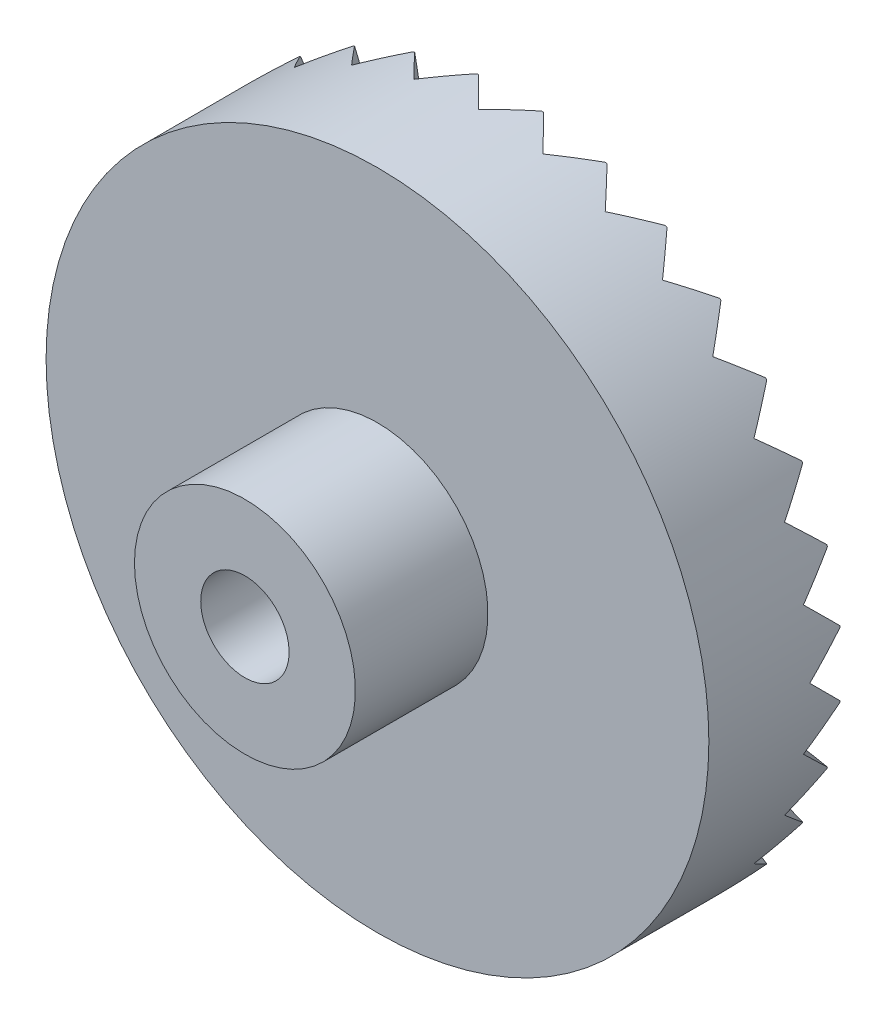
from build123d import *

# Parameters (mm, degrees)
CUT_EXTRUDE1_DEPTH = 10
CIRPATTERN1_COUNT  = 32


with BuildPart() as part:
    # Sketch1 → Revolve1 (revolve)
    with BuildSketch(Plane(origin=(0, 0, 0), x_dir=(1, 0, 0), z_dir=(0, 1, 0)), mode=Mode.PRIVATE) as revolve1_sk:
        Polygon((1, 0), (6.5, 0), (6.5, 2), (7.5, 2), (7.5, -1), (2.5, -1), (2.5, -4), (1, -4), align=None)
    revolve(revolve1_sk.sketch.rotate(Axis((0, 0, -10.710116732), (0, 0, 1)), 180), axis=Axis((0, 0, -10.710116732), (0, 0, 1)))

    # Sketch2 → Cut-Extrude1 (cut)
    with BuildSketch(Plane(origin=(0, 0, 0), x_dir=(1, 0, 0), z_dir=(0, 1, 0))):
        Polygon((0, 1.284275778), (2.060090555, 3.344366332), (-2.060090555, 3.344366332), align=None)
    cut_extrude1 = extrude(amount=-CUT_EXTRUDE1_DEPTH, mode=Mode.SUBTRACT)

    # CirPattern1: Cut-Extrude1 ×32 about axis
    cirpattern1_axis = Axis((0, 0, 0), (0, 0, 1))
    for i in range(1, CIRPATTERN1_COUNT):
        add(cut_extrude1.rotate(cirpattern1_axis, i * 360 / CIRPATTERN1_COUNT), mode=Mode.SUBTRACT)


solid = part.part
